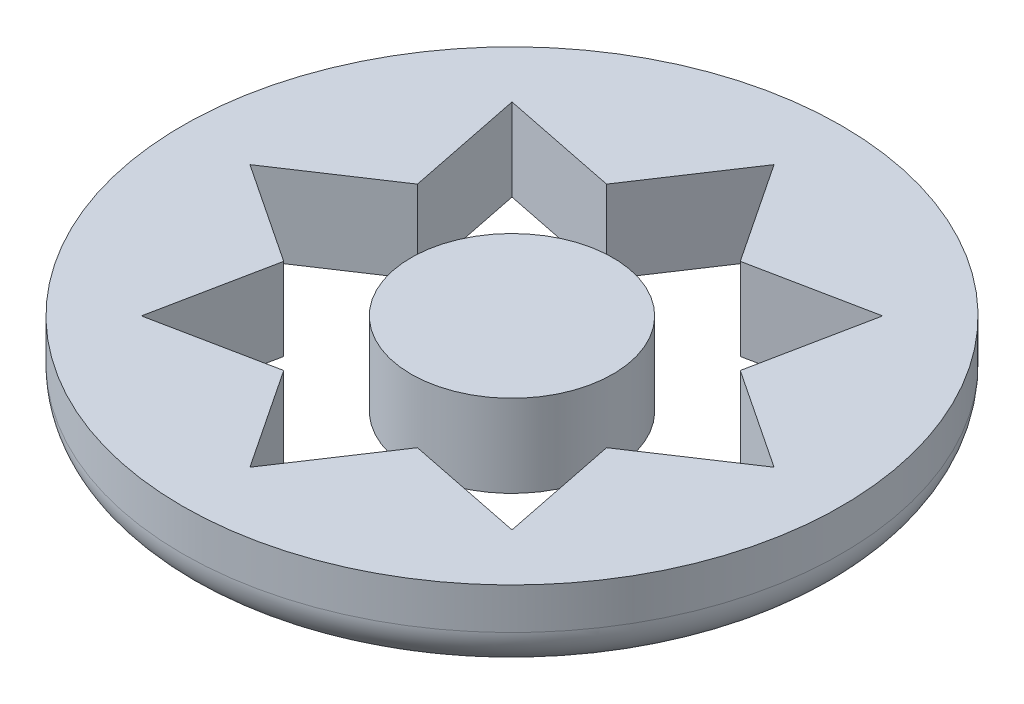
from build123d import *

# Parameters (mm, degrees)
SKETCH1_R           = 8
BOSS_EXTRUDE1_DEPTH = 2
FILLET1_R           = 1
SKETCH2_R           = 2.45
BOSS_EXTRUDE2_DEPTH = 2


with BuildPart() as part:
    # Sketch1 → Boss-Extrude1 (new body)
    with BuildSketch(Plane(origin=(0, 0, 0), x_dir=(1, 0, 0), z_dir=(0, 1, 0))):
        with Locations(Location((0, 0, 0), (0, 0, 270))):
            Circle(SKETCH1_R)
        Polygon((-3.918152642, 1.622951964), (-4.498236304, 4.498236304), (-1.622951964, 3.918152642), (0, 6.361466788), (1.622951964, 3.918152642), (4.498236304, 4.498236304), (3.918152642, 1.622951964), (6.361466788, 0), (3.918152642, -1.622951964), (4.498236304, -4.498236304), (1.622951964, -3.918152642), (0, -6.361466788), (-1.622951964, -3.918152642), (-4.498236304, -4.498236304), (-3.918152642, -1.622951964), (-6.361466788, 0), align=None, mode=Mode.SUBTRACT)
    extrude(amount=BOSS_EXTRUDE1_DEPTH)

    # Fillet1
    fillet1_edges = [part.edges().sort_by_distance(p)[0] for p in [
        (0, 0, -8),
    ]]
    fillet(fillet1_edges, radius=FILLET1_R)


with BuildPart() as body_2:
    # Sketch2 → Boss-Extrude2 (new body)
    with BuildSketch(Plane(origin=(0, 2, 0), x_dir=(1, 0, 0), z_dir=(0, 1, 0))):
        with Locations(Location((0, 0, 0), (0, 0, 270))):
            Circle(SKETCH2_R)
    extrude(amount=-BOSS_EXTRUDE2_DEPTH)


solid = Compound([part.part, body_2.part])
